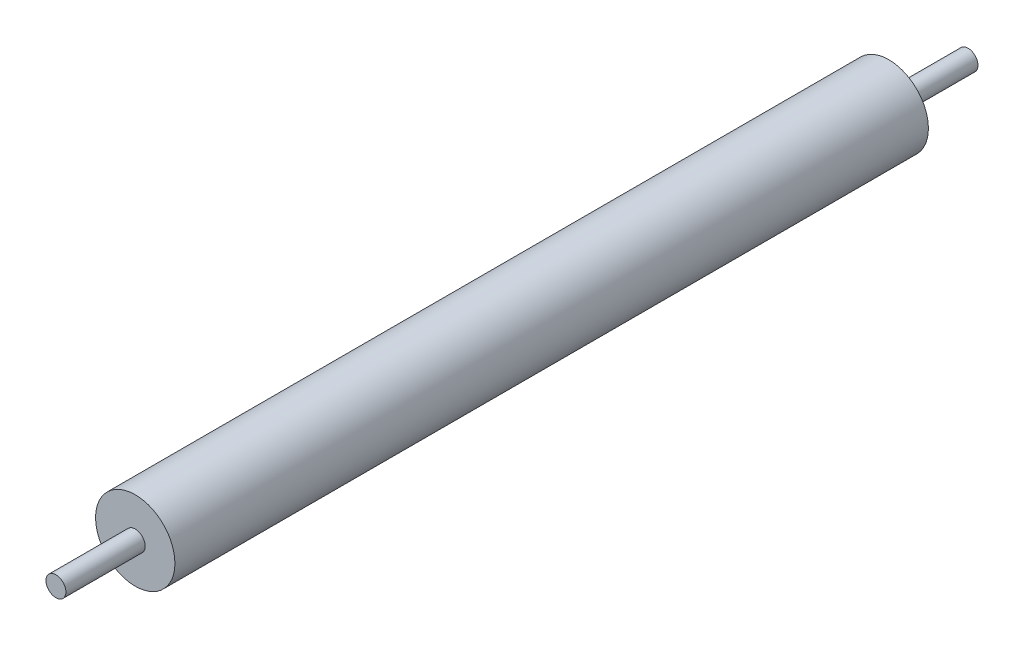
from build123d import *

# Parameters (mm, degrees)
SKETCH1_R           = 25.4
BOSS_EXTRUDE1_DEPTH = 584.2
SKETCH2_OUTSIDE_W   = 170.52
SKETCH2_OUTSIDE_H   = 170.52
SKETCH2_OUTSIDE_R   = 6.361935525
CUT_EXTRUDE1_DEPTH  = 50.8
SKETCH5_OUTSIDE_W   = 170.52
SKETCH5_OUTSIDE_H   = 170.52
SKETCH5_OUTSIDE_R   = 6.377907631
CUT_EXTRUDE4_DEPTH  = 50.8


with BuildPart() as part:
    # Sketch1 → Boss-Extrude1 (new body)
    with BuildSketch(Plane.XY):
        Circle(SKETCH1_R)
    extrude(amount=BOSS_EXTRUDE1_DEPTH)

    # Sketch2 outside → Cut-Extrude1 (cut)
    with BuildSketch(Plane.XY):
        Rectangle(SKETCH2_OUTSIDE_W, SKETCH2_OUTSIDE_H)
        Circle(SKETCH2_OUTSIDE_R, mode=Mode.SUBTRACT)
    extrude(amount=CUT_EXTRUDE1_DEPTH, mode=Mode.SUBTRACT)

    # Sketch5 outside → Cut-Extrude4 (cut)
    with BuildSketch(Plane.XY.offset(584.2)):
        Rectangle(SKETCH5_OUTSIDE_W, SKETCH5_OUTSIDE_H)
        Circle(SKETCH5_OUTSIDE_R, mode=Mode.SUBTRACT)
    extrude(amount=-CUT_EXTRUDE4_DEPTH, mode=Mode.SUBTRACT)


solid = part.part
